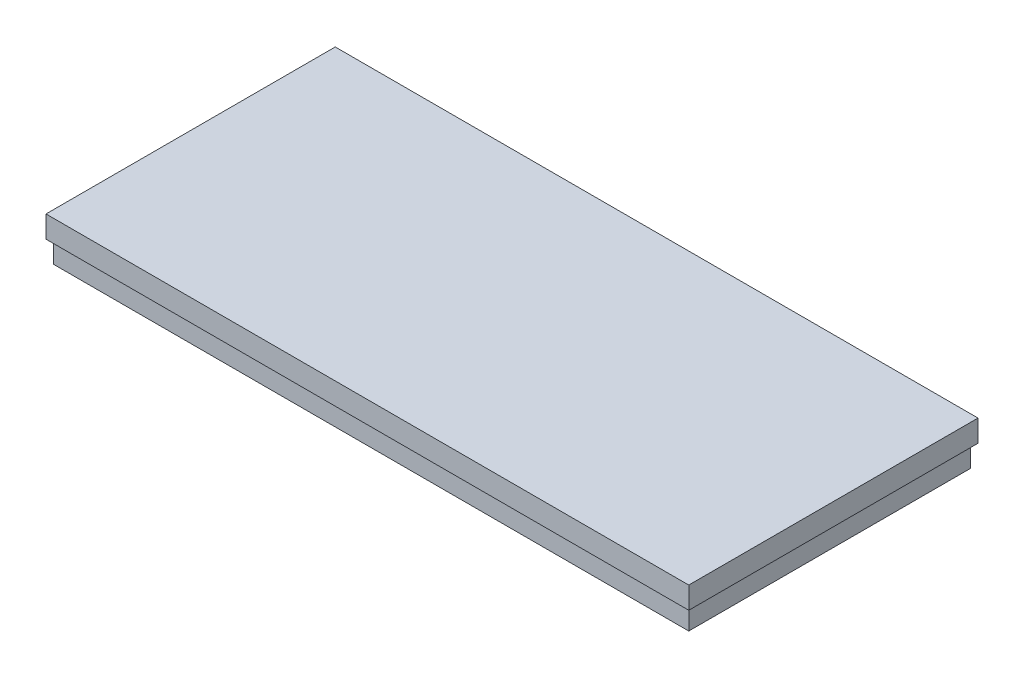
from build123d import *

# Parameters (mm, degrees)
SKETCH3_W           = 197.6
SKETCH3_H           = 87.6
BOSS_EXTRUDE2_DEPTH = 6.8
SKETCH4_W           = 200
SKETCH4_H           = 90
BOSS_EXTRUDE3_DEPTH = 6.8


with BuildPart() as part:
    # Sketch3 → Boss-Extrude2 (new body)
    with BuildSketch(Plane(origin=(0, 0, 0), x_dir=(1, 0, 0), z_dir=(0, 1, 0))):
        with Locations((99.828511242, -89.822579534)):
            Rectangle(SKETCH3_W, SKETCH3_H)
    extrude(amount=BOSS_EXTRUDE2_DEPTH)

    # Sketch4 → Boss-Extrude3 (add)
    with BuildSketch(Plane(origin=(0, 6.8, 0), x_dir=(1, 0, 0), z_dir=(0, 1, 0))):
        with Locations((99.828511242, -89.822579534)):
            Rectangle(SKETCH4_W, SKETCH4_H)
    extrude(amount=BOSS_EXTRUDE3_DEPTH)


solid = part.part
